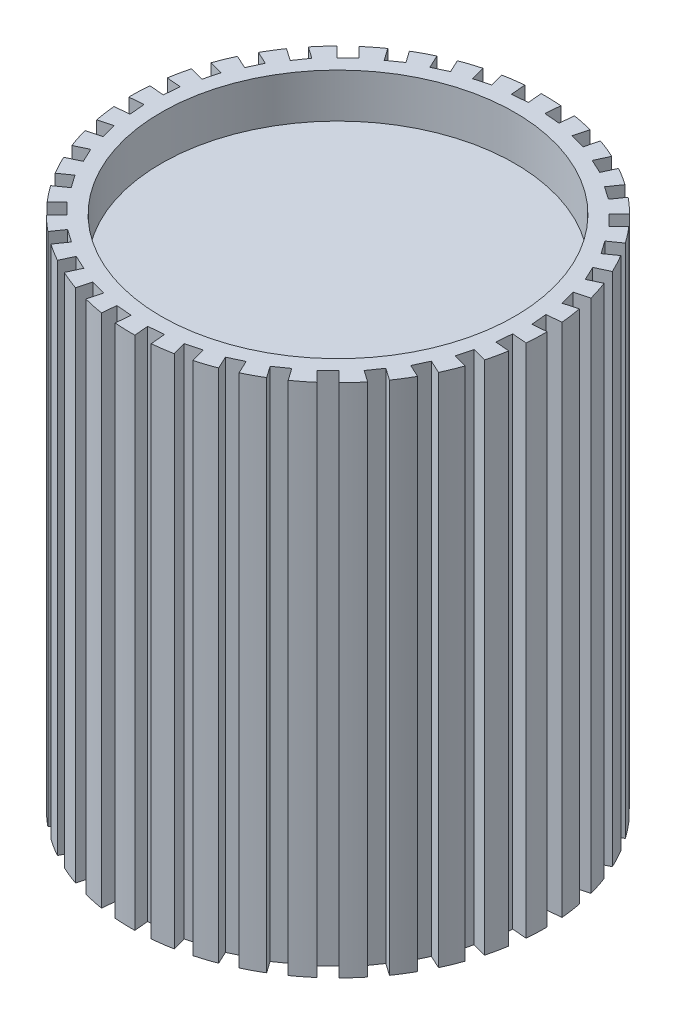
from build123d import *

# Parameters (mm, degrees)
SKETCH_1_R          = 13
EXTRUDE_1_DEPTH     = 35
SKETCH_6_R          = 14
EXTRUDE_4_DEPTH     = 35
SKETCH_2_R          = 12
CUT_EXTRUDE_1_DEPTH = 3
CUT_EXTRUDE_2_DEPTH = 41.211938526


with BuildPart() as part:
    # 草图1 → 凸台-拉伸1 (new body)
    with BuildSketch(Plane(origin=(0, 0, 0), x_dir=(1, 0, 0), z_dir=(0, 1, 0))):
        with Locations(Location((0, 0, 0), (0, 0, 270))):
            Circle(SKETCH_1_R)
    extrude(amount=EXTRUDE_1_DEPTH)

    # 草图6 → 凸台-拉伸4 (add, through all)
    with BuildSketch(Plane(origin=(0, 35, 0), x_dir=(1, 0, 0), z_dir=(0, 1, 0))):
        with Locations(Location((0, 0, 0), (0, 0, 270))):
            Circle(SKETCH_6_R)
    extrude(amount=-EXTRUDE_4_DEPTH)

    # 草图2 → 切除-拉伸1 (cut)
    with BuildSketch(Plane(origin=(0, 35, 0), x_dir=(1, 0, 0), z_dir=(0, 1, 0))):
        with Locations(Location((0, 0, 0), (0, 0, 270))):
            Circle(SKETCH_2_R)
    extrude(amount=-CUT_EXTRUDE_1_DEPTH, mode=Mode.SUBTRACT)

    # 草图7 → 切除-拉伸2 (cut, through all)
    with BuildSketch(Plane(origin=(0, 35, 0), x_dir=(1, 0, 0), z_dir=(0, 1, 0))):
        Polygon((-15.646830527, 4.142221687), (-12.567085782, 3.326913727), (-12.296421758, 4.349320163), (-15.376166503, 5.164628122), align=None)
        Polygon((-14.689830765, 6.79633564), (-11.798451005, 5.458621977), (-11.354359961, 6.418495447), (-14.245739722, 7.756209109), align=None)
        Polygon((-13.28648793, 9.243946373), (-10.671326264, 7.42447276), (-10.067301683, 8.292647994), (-12.682463348, 10.112121607), align=None)
        Polygon((-11.479441881, 11.410684473), (-9.219958675, 9.164734695), (-8.474353537, 9.914832629), (-10.733836743, 12.160782407), align=None)
        Polygon((-9.3235988, 13.230714699), (-7.488447307, 10.626530804), (-6.623916447, 11.235760092), (-8.45906794, 13.839943987), align=None)
        Polygon((-6.884462888, 14.648736355), (-5.529403257, 11.765445152), (-4.572215008, 12.215294669), (-5.927274639, 15.098585872), align=None)
        Polygon((-4.236146054, 15.621663569), (-3.402351087, 12.546872402), (-2.381589129, 12.8236737), (-3.215384096, 15.898464866), align=None)
        Polygon((-1.459116066, 16.11993444), (-1.171920201, 12.947069284), (-0.11859987, 13.042411894), (-0.405795735, 16.21527705), align=None)
        Polygon((1.362248425, 16.12840926), (1.094118888, 12.953876017), (2.147992986, 12.864863002), (2.416122524, 16.039396246), align=None)
        Polygon((4.142221687, 15.646830527), (3.326913727, 12.567085782), (4.349320163, 12.296421758), (5.164628122, 15.376166503), align=None)
        Polygon((6.79633564, 14.689830765), (5.458621977, 11.798451005), (6.418495447, 11.354359961), (7.756209109, 14.245739722), align=None)
        Polygon((9.243946373, 13.28648793), (7.42447276, 10.671326264), (8.292647994, 10.067301683), (10.112121607, 12.682463348), align=None)
        Polygon((11.410684473, 11.479441881), (9.164734695, 9.219958675), (9.914832629, 8.474353537), (12.160782407, 10.733836743), align=None)
        Polygon((13.230714699, 9.3235988), (10.626530804, 7.488447307), (11.235760092, 6.623916447), (13.839943987, 8.45906794), align=None)
        Polygon((14.648736355, 6.884462888), (11.765445152, 5.529403257), (12.215294669, 4.572215008), (15.098585872, 5.927274639), align=None)
        Polygon((15.621663569, 4.236146054), (12.546872402, 3.402351087), (12.8236737, 2.381589129), (15.898464866, 3.215384096), align=None)
        Polygon((16.11993444, 1.459116066), (12.947069284, 1.171920201), (13.042411894, 0.11859987), (16.21527705, 0.405795735), align=None)
        Polygon((16.12840926, -1.362248425), (12.953876017, -1.094118888), (12.864863002, -2.147992986), (16.039396246, -2.416122524), align=None)
        Polygon((15.646830527, -4.142221687), (12.567085782, -3.326913727), (12.296421758, -4.349320163), (15.376166503, -5.164628122), align=None)
        Polygon((14.689830765, -6.79633564), (11.798451005, -5.458621977), (11.354359961, -6.418495447), (14.245739722, -7.756209109), align=None)
        Polygon((13.28648793, -9.243946373), (10.671326264, -7.42447276), (10.067301683, -8.292647994), (12.682463348, -10.112121607), align=None)
        Polygon((11.479441881, -11.410684473), (9.219958675, -9.164734695), (8.474353537, -9.914832629), (10.733836743, -12.160782407), align=None)
        Polygon((9.3235988, -13.230714699), (7.488447307, -10.626530804), (6.623916447, -11.235760092), (8.45906794, -13.839943987), align=None)
        Polygon((6.884462888, -14.648736355), (5.529403257, -11.765445152), (4.572215008, -12.215294669), (5.927274639, -15.098585872), align=None)
        Polygon((4.236146054, -15.621663569), (3.402351087, -12.546872402), (2.381589129, -12.8236737), (3.215384096, -15.898464866), align=None)
        Polygon((1.459116066, -16.11993444), (1.171920201, -12.947069284), (0.11859987, -13.042411894), (0.405795735, -16.21527705), align=None)
        Polygon((-1.362248425, -16.12840926), (-1.094118888, -12.953876017), (-2.147992986, -12.864863002), (-2.416122524, -16.039396246), align=None)
        Polygon((-4.142221687, -15.646830527), (-3.326913727, -12.567085782), (-4.349320163, -12.296421758), (-5.164628122, -15.376166503), align=None)
        Polygon((-6.79633564, -14.689830765), (-5.458621977, -11.798451005), (-6.418495447, -11.354359961), (-7.756209109, -14.245739722), align=None)
        Polygon((-9.243946373, -13.28648793), (-7.42447276, -10.671326264), (-8.292647994, -10.067301683), (-10.112121607, -12.682463348), align=None)
        Polygon((-11.410684473, -11.479441881), (-9.164734695, -9.219958675), (-9.914832629, -8.474353537), (-12.160782407, -10.733836743), align=None)
        Polygon((-13.230714699, -9.3235988), (-10.626530804, -7.488447307), (-11.235760092, -6.623916447), (-13.839943987, -8.45906794), align=None)
        Polygon((-14.648736355, -6.884462888), (-11.765445152, -5.529403257), (-12.215294669, -4.572215008), (-15.098585872, -5.927274639), align=None)
        Polygon((-15.621663569, -4.236146054), (-12.546872402, -3.402351087), (-12.8236737, -2.381589129), (-15.898464866, -3.215384096), align=None)
        Polygon((-16.11993444, -1.459116066), (-12.947069284, -1.171920201), (-13.042411894, -0.11859987), (-16.21527705, -0.405795735), align=None)
        Polygon((-16.12840926, 1.362248425), (-12.953876017, 1.094118888), (-12.864863002, 2.147992986), (-16.039396246, 2.416122524), align=None)
    extrude(amount=-CUT_EXTRUDE_2_DEPTH, mode=Mode.SUBTRACT)


solid = part.part
